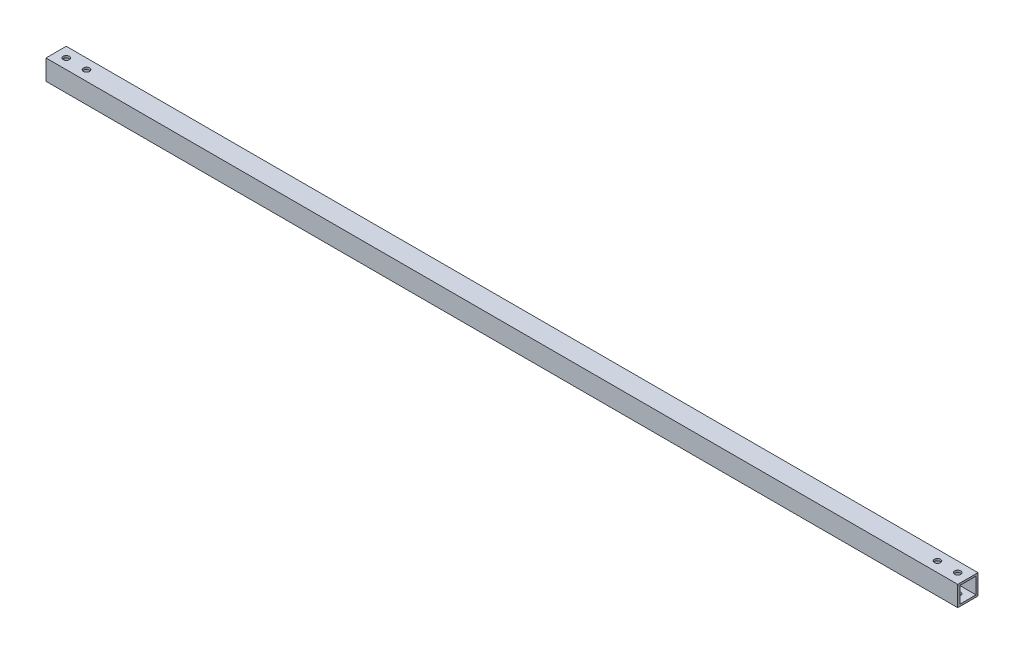
from build123d import *

# Parameters (mm, degrees)
SKETCH1_W           = 20
SKETCH1_H           = 20
SKETCH1_W_2         = 16
SKETCH1_H_2         = 16
BOSS_EXTRUDE1_DEPTH = 450
SKETCH2_R           = 3
CUT_EXTRUDE1_DEPTH  = 451.555213043


with BuildPart() as part:
    # Sketch1 → Boss-Extrude1 (new, symmetric)
    with BuildSketch(Plane(origin=(0, 0, 0), x_dir=(0, 0, -1), z_dir=(1, 0, 0))):
        Rectangle(SKETCH1_W, SKETCH1_H)
        Rectangle(SKETCH1_W_2, SKETCH1_H_2, mode=Mode.SUBTRACT)
    extrude(amount=BOSS_EXTRUDE1_DEPTH, both=True)

    # Sketch2 → Cut-Extrude1 (cut, through all)
    with BuildSketch(Plane(origin=(0, 10, 0), x_dir=(1, 0, 0), z_dir=(0, 1, 0))):
        with Locations(Location((420, 0, 0), (0, 0, 270))):
            Circle(SKETCH2_R)
        with Locations(Location((440, 0, 0), (0, 0, 270))):
            Circle(SKETCH2_R)
        with Locations(Location((-440, 0, 0), (0, 0, 270))):
            Circle(SKETCH2_R)
        with Locations(Location((-420, 0, 0), (0, 0, 270))):
            Circle(SKETCH2_R)
    extrude(amount=-CUT_EXTRUDE1_DEPTH, mode=Mode.SUBTRACT)


solid = part.part
